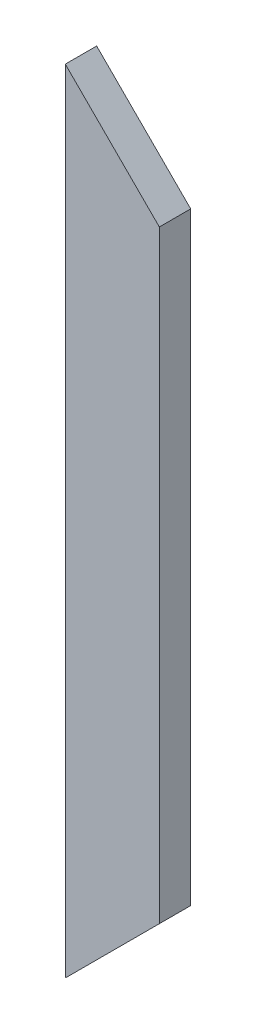
from build123d import *

# Parameters (mm, degrees)
SKETCH1_W           = 76.2
SKETCH1_H           = 641.35
BOSS_EXTRUDE1_DEPTH = 25.4
CUT_EXTRUDE1_DEPTH  = 25.4
CUT_EXTRUDE2_DEPTH  = 25.4


with BuildPart() as part:
    # Sketch1 → Boss-Extrude1 (new body)
    with BuildSketch(Plane.XY):
        Rectangle(SKETCH1_W, SKETCH1_H)
    extrude(amount=BOSS_EXTRUDE1_DEPTH)

    # Sketch2 → Cut-Extrude1 (cut)
    with BuildSketch(Plane.XY.offset(25.4)):
        Polygon((-38.1, -320.675), (38.1, -244.475), (38.1, -320.675), align=None)
    extrude(amount=-CUT_EXTRUDE1_DEPTH, mode=Mode.SUBTRACT)

    # Sketch3 → Cut-Extrude2 (cut)
    with BuildSketch(Plane.XY.offset(25.4)):
        Polygon((-38.1, 320.675), (38.1, 244.475), (38.1, 320.675), align=None)
    extrude(amount=-CUT_EXTRUDE2_DEPTH, mode=Mode.SUBTRACT)


solid = part.part
